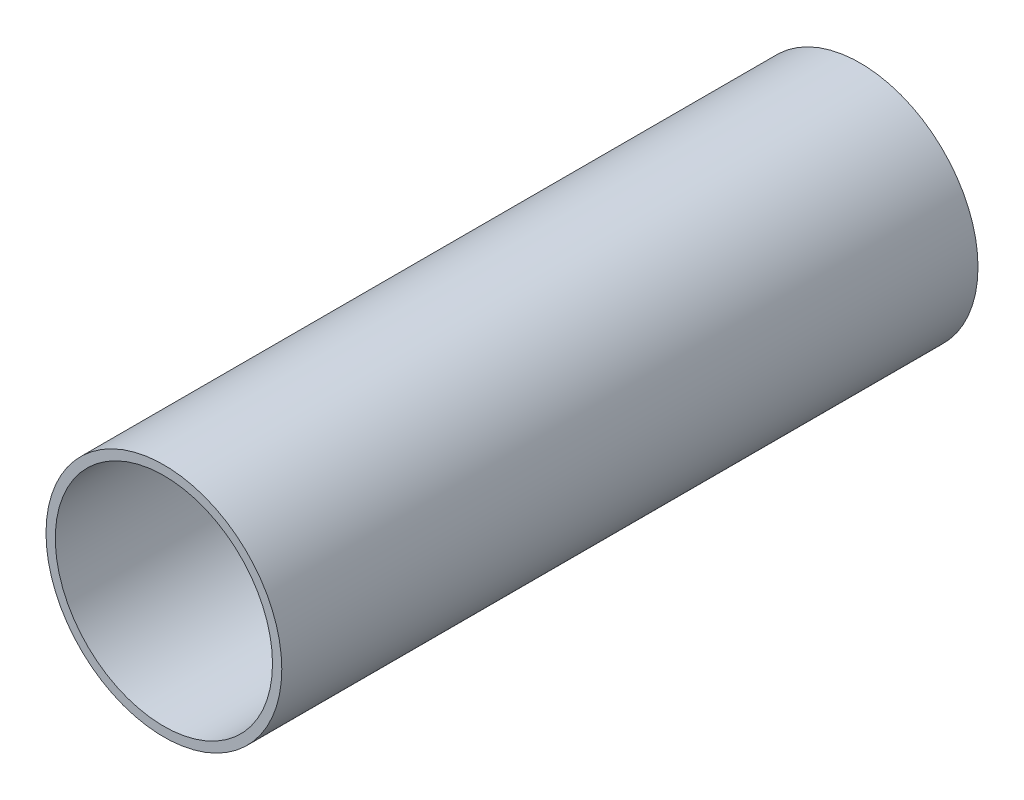
from build123d import *

# Parameters (mm, degrees)
ESBO_O1_R                = 25.4
ESBO_O1_R_2              = 23.4
RESSALTO_EXTRUS_O1_DEPTH = 150


with BuildPart() as part:
    # Esboço1 → Ressalto-extrusão1 (new body)
    with BuildSketch(Plane.XY):
        Circle(ESBO_O1_R)
        Circle(ESBO_O1_R_2, mode=Mode.SUBTRACT)
    extrude(amount=RESSALTO_EXTRUS_O1_DEPTH)


solid = part.part
